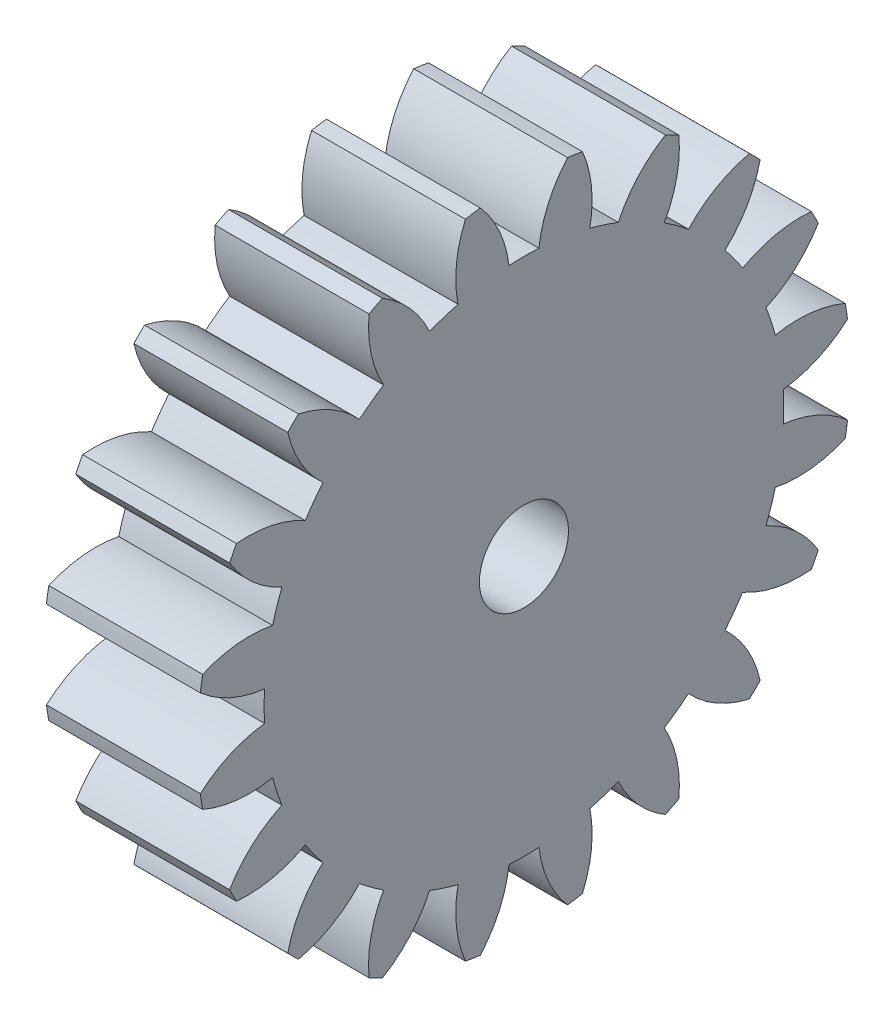
from build123d import *

# Parameters (mm, degrees)
BASPROSKE_W     = 5.4864
BASPROSKE_H     = 11.641666667
TOOTHCUT_DEPTH  = 18.353886899
TEETHCUTS_COUNT = 20
TEETHCUTS_ANGLE = 342
BORSKE_R        = 1.5875
BORE_DEPTH      = 50.8000508


with BuildPart() as part:
    # BasProSke → Base-Revolve (revolve)
    with BuildSketch(Plane(origin=(0, 0, 0), x_dir=(1, 0, 0), z_dir=(0, 1, 0)), mode=Mode.PRIVATE) as base_revolve_sk:
        with Locations((2.7432, 5.820833334)):
            Rectangle(BASPROSKE_W, BASPROSKE_H)
    revolve(base_revolve_sk.sketch.rotate(Axis((-10, 0, 0), (1, 0, 0)), 180), axis=Axis((-10, 0, 0), (1, 0, 0)))

    # TooCutSke → ToothCut (cut, through all)
    with BuildSketch(Plane(origin=(0, 0, 0), x_dir=(0, 0, -1), z_dir=(1, 0, 0))):
        with BuildLine():
            ThreePointArc((0.533225418, 9.247172238), (0, 9.262533333), (-0.533225418, 9.247172238))
            ThreePointArc((-0.533225418, 9.247172238), (-0.876940109, 10.483598528), (-1.575347052, 11.560221722))
            ThreePointArc((-1.575347052, 11.560221722), (0, 11.667066667), (1.575347052, 11.560221722))
            ThreePointArc((1.575347052, 11.560221722), (0.876940109, 10.483598528), (0.533225418, 9.247172238))
        make_face()
    toothcut = extrude(amount=TOOTHCUT_DEPTH, mode=Mode.SUBTRACT)

    # TeethCuts: ToothCut ×20 about axis
    teethcuts_axis = Axis((-10, 0, 0), (1, 0, 0))
    for i in range(1, TEETHCUTS_COUNT):
        add(toothcut.rotate(teethcuts_axis, i * TEETHCUTS_ANGLE / (TEETHCUTS_COUNT - 1)), mode=Mode.SUBTRACT)

    # BorSke → Bore (cut, symmetric)
    with BuildSketch(Plane(origin=(0, 0, 0), x_dir=(0, 0, -1), z_dir=(1, 0, 0))):
        with Locations(Location((0, 0, 0), (0, 0, 180))):
            Circle(BORSKE_R)
    extrude(amount=BORE_DEPTH, both=True, mode=Mode.SUBTRACT)


solid = part.part
